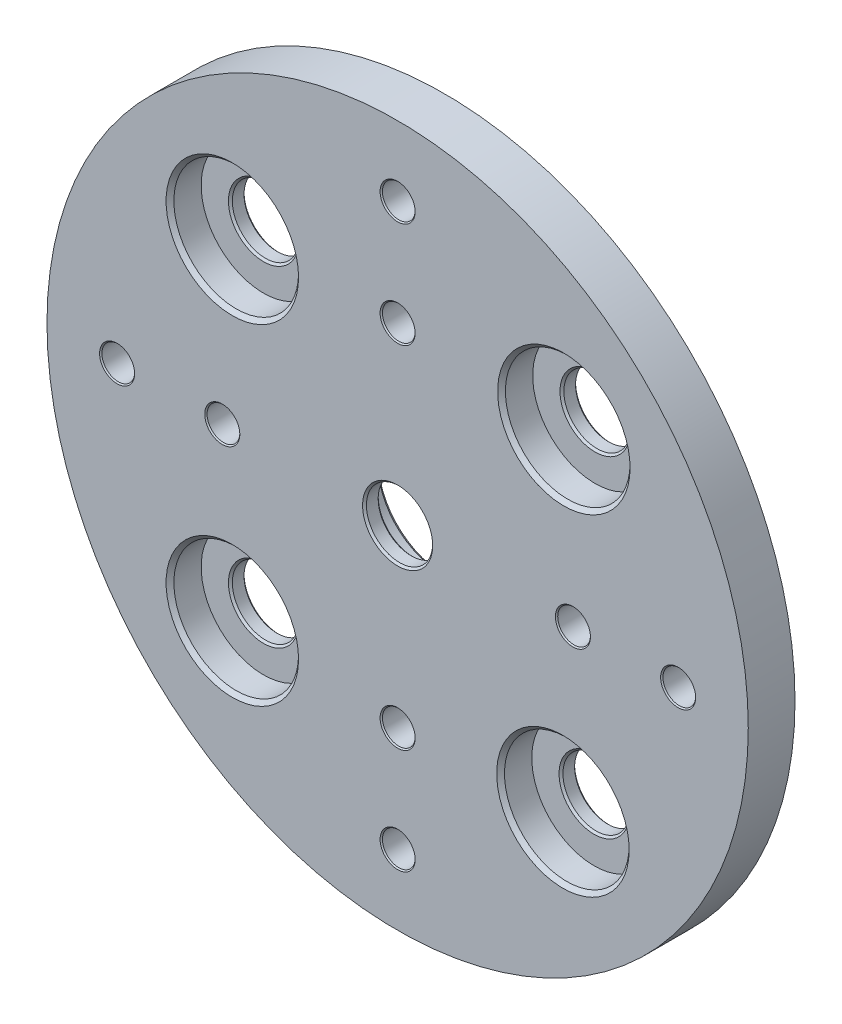
from build123d import *

# Parameters (mm, degrees)
SKETCH1_R                                      = 90
BOSS_EXTRUDE1_DEPTH                            = 12
CBORE_FOR_M5_HEX_HEAD_BOLT1_AT_2_COUNT         = 2
CBORE_FOR_M5_HEX_HEAD_BOLT1_AT_2_PITCH         = 85.093412723
CBORE_FOR_M5_HEX_HEAD_BOLT1_AT_3_COUNT         = 2
CBORE_FOR_M5_HEX_HEAD_BOLT1_AT_3_PITCH         = 120.339778661
CBORE_FOR_M5_HEX_HEAD_BOLT1_AT_4_COUNT         = 2
CBORE_FOR_M5_HEX_HEAD_BOLT1_AT_4_PITCH         = 85.093412723
CSK_FOR_M5_FLAT_HEAD_MACHINE_SCREW1_AT_2_COUNT = 2
CSK_FOR_M5_FLAT_HEAD_MACHINE_SCREW1_AT_2_PITCH = 63.63491592
CSK_FOR_M5_FLAT_HEAD_MACHINE_SCREW1_AT_3_COUNT = 2
CSK_FOR_M5_FLAT_HEAD_MACHINE_SCREW1_AT_3_PITCH = 89.995540664
CSK_FOR_M5_FLAT_HEAD_MACHINE_SCREW1_AT_4_COUNT = 2
CSK_FOR_M5_FLAT_HEAD_MACHINE_SCREW1_AT_4_PITCH = 63.627500237
CSK_FOR_M5_FLAT_HEAD_MACHINE_SCREW2_AT_2_COUNT = 2
CSK_FOR_M5_FLAT_HEAD_MACHINE_SCREW2_AT_2_PITCH = 101.823376491
CSK_FOR_M5_FLAT_HEAD_MACHINE_SCREW2_AT_3_COUNT = 2
CSK_FOR_M5_FLAT_HEAD_MACHINE_SCREW2_AT_3_PITCH = 144
CSK_FOR_M5_FLAT_HEAD_MACHINE_SCREW2_AT_4_COUNT = 2
CSK_FOR_M5_FLAT_HEAD_MACHINE_SCREW2_AT_4_PITCH = 101.823376491


with BuildPart() as part:
    # Sketch1 → Boss-Extrude1 (new body)
    with BuildSketch(Plane.XY):
        Circle(SKETCH1_R)
    extrude(amount=BOSS_EXTRUDE1_DEPTH)

    # Sketch4 → CBORE for M5 Hex Head Bolt1 (revolve, cut)
    with BuildSketch(Plane(origin=(42.666666667, 42.666666667, 12), x_dir=(0, -1, 0), z_dir=(1, 0, 0))):
        Polygon((0, 0), (0, 12), (9, 12), (8.5, 11.5), (8.5, 8.5), (9, 8), (16, 8), (16, 1), (17, 0), align=None)
    cbore_for_m5_hex_head_bolt1 = revolve(axis=Axis((42.666666667, 42.666666667, 18.35), (0, 0, -1)), mode=Mode.SUBTRACT)

    # CBORE for M5 Hex Head Bolt1 at 2: CBORE for M5 Hex Head Bolt1 ×2
    with Locations(*[Vector(-0.0028234828970208348, -0.9999960139642209, 0) * (i * CBORE_FOR_M5_HEX_HEAD_BOLT1_AT_2_PITCH) for i in range(1, CBORE_FOR_M5_HEX_HEAD_BOLT1_AT_2_COUNT)]):
        add(cbore_for_m5_hex_head_bolt1, mode=Mode.SUBTRACT)

    # CBORE for M5 Hex Head Bolt1 at 3: CBORE for M5 Hex Head Bolt1 ×2
    with Locations(*[Vector(-0.7071067811865486, -0.7071067811865465, 0) * (i * CBORE_FOR_M5_HEX_HEAD_BOLT1_AT_3_PITCH) for i in range(1, CBORE_FOR_M5_HEX_HEAD_BOLT1_AT_3_COUNT)]):
        add(cbore_for_m5_hex_head_bolt1, mode=Mode.SUBTRACT)

    # CBORE for M5 Hex Head Bolt1 at 4: CBORE for M5 Hex Head Bolt1 ×2
    with Locations(*[Vector(-0.9999960139642209, -0.002823482897031568, 0) * (i * CBORE_FOR_M5_HEX_HEAD_BOLT1_AT_4_PITCH) for i in range(1, CBORE_FOR_M5_HEX_HEAD_BOLT1_AT_4_COUNT)]):
        add(cbore_for_m5_hex_head_bolt1, mode=Mode.SUBTRACT)

    # Sketch5 → CBORE for M5 Hex Head Bolt2 (revolve, cut)
    with BuildSketch(Plane.YZ):
        Polygon((0, 0), (0, 12), (9, 12), (8.5, 11.5), (8.5, 8.5), (9, 8), (16, 8), (16, 1), (17, 0), align=None)
    revolve(axis=Axis((0, 0, -6.35), (0, 0, 1)), mode=Mode.SUBTRACT)

    # Sketch6 → CSK for M5 Flat Head Machine Screw1 (revolve, cut)
    with BuildSketch(Plane(origin=(44.991952442, -0.003388792, 0), x_dir=(0, 1, 0), z_dir=(1, 0, 0))):
        Polygon((0, 0), (0, 12), (4.5, 12), (4.2, 11.7), (4.2, 4.8), (9, 0), align=None)
    csk_for_m5_flat_head_machine_screw1 = revolve(axis=Axis((44.991952442, -0.003388792, -6.35), (0, 0, 1)), mode=Mode.SUBTRACT)

    # CSK for M5 Flat Head Machine Screw1 at 2: CSK for M5 Flat Head Machine Screw1 ×2
    with Locations(*[Vector(-0.7070545332830015, 0.7071590252297972, 0) * (i * CSK_FOR_M5_FLAT_HEAD_MACHINE_SCREW1_AT_2_PITCH) for i in range(1, CSK_FOR_M5_FLAT_HEAD_MACHINE_SCREW1_AT_2_COUNT)]):
        add(csk_for_m5_flat_head_machine_screw1, mode=Mode.SUBTRACT)

    # CSK for M5 Flat Head Machine Screw1 at 3: CSK for M5 Flat Head Machine Screw1 ×2
    with Locations(*[Vector(-0.9999999985437752, 5.396711723824618e-05, 0) * (i * CSK_FOR_M5_FLAT_HEAD_MACHINE_SCREW1_AT_3_PITCH) for i in range(1, CSK_FOR_M5_FLAT_HEAD_MACHINE_SCREW1_AT_3_COUNT)]):
        add(csk_for_m5_flat_head_machine_screw1, mode=Mode.SUBTRACT)

    # CSK for M5 Flat Head Machine Screw1 at 4: CSK for M5 Flat Head Machine Screw1 ×2
    with Locations(*[Vector(-0.707086531592279, -0.7071270302009401, 0) * (i * CSK_FOR_M5_FLAT_HEAD_MACHINE_SCREW1_AT_4_PITCH) for i in range(1, CSK_FOR_M5_FLAT_HEAD_MACHINE_SCREW1_AT_4_COUNT)]):
        add(csk_for_m5_flat_head_machine_screw1, mode=Mode.SUBTRACT)

    # Sketch8 → CSK for M5 Flat Head Machine Screw2 (revolve, cut)
    with BuildSketch(Plane(origin=(-72, 0, 12), x_dir=(0, -1, 0), z_dir=(1, 0, 0))):
        Polygon((0, 0), (0, 12), (4.5, 12), (4.2, 11.7), (4.2, 0.3), (4.5, 0), align=None)
    csk_for_m5_flat_head_machine_screw2 = revolve(axis=Axis((-72, 0, 18.35), (0, 0, -1)), mode=Mode.SUBTRACT)

    # CSK for M5 Flat Head Machine Screw2 at 2: CSK for M5 Flat Head Machine Screw2 ×2
    with Locations(*[Vector(0.7071067811865477, 0.7071067811865474, 0) * (i * CSK_FOR_M5_FLAT_HEAD_MACHINE_SCREW2_AT_2_PITCH) for i in range(1, CSK_FOR_M5_FLAT_HEAD_MACHINE_SCREW2_AT_2_COUNT)]):
        add(csk_for_m5_flat_head_machine_screw2, mode=Mode.SUBTRACT)

    # CSK for M5 Flat Head Machine Screw2 at 3: CSK for M5 Flat Head Machine Screw2 ×2
    with Locations(*[(i * CSK_FOR_M5_FLAT_HEAD_MACHINE_SCREW2_AT_3_PITCH, 0, 0) for i in range(1, CSK_FOR_M5_FLAT_HEAD_MACHINE_SCREW2_AT_3_COUNT)]):
        add(csk_for_m5_flat_head_machine_screw2, mode=Mode.SUBTRACT)

    # CSK for M5 Flat Head Machine Screw2 at 4: CSK for M5 Flat Head Machine Screw2 ×2
    with Locations(*[Vector(0.7071067811865475, -0.7071067811865476, 0) * (i * CSK_FOR_M5_FLAT_HEAD_MACHINE_SCREW2_AT_4_PITCH) for i in range(1, CSK_FOR_M5_FLAT_HEAD_MACHINE_SCREW2_AT_4_COUNT)]):
        add(csk_for_m5_flat_head_machine_screw2, mode=Mode.SUBTRACT)


solid = part.part
